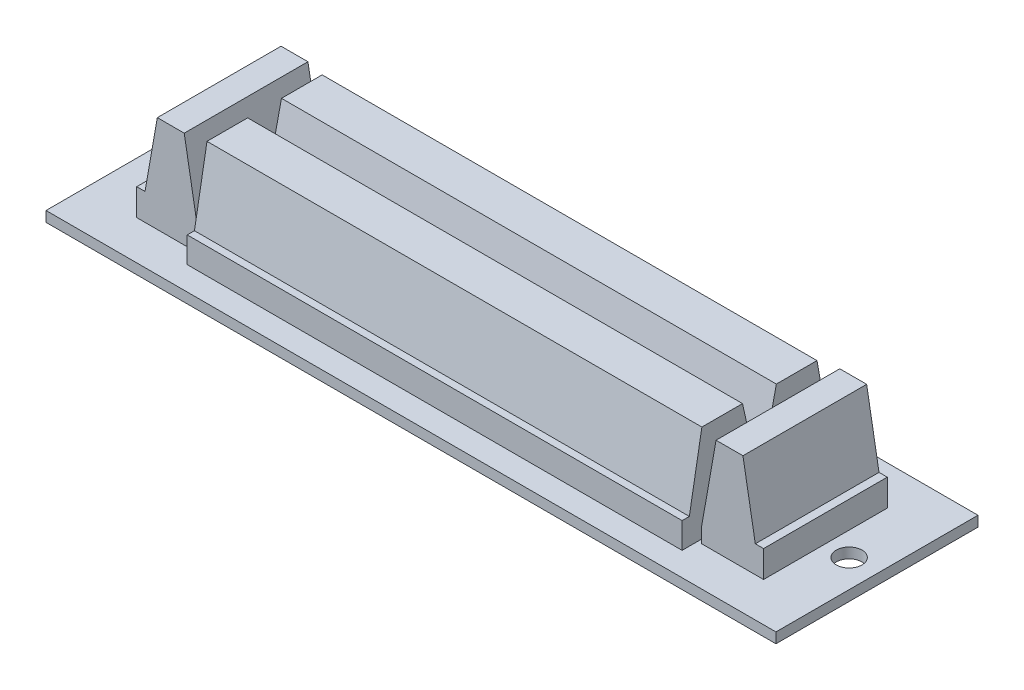
from build123d import *

# Parameters (mm, degrees)
SKETCH1_W           = 89.916
SKETCH1_H           = 24.892
SKETCH1_R           = 1.5875
BOSS_EXTRUDE1_DEPTH = 0.635
BOSS_EXTRUDE2_DEPTH = 30.48
BOSS_EXTRUDE3_DEPTH = 7.62


with BuildPart() as part:
    # Sketch1 → Boss-Extrude1 (new, symmetric)
    with BuildSketch(Plane(origin=(0, 0, 0), x_dir=(1, 0, 0), z_dir=(0, 1, 0))):
        Rectangle(SKETCH1_W, SKETCH1_H)
        with Locations(Location((-41.529, 0, 0), (0, 0, 270))):
            Circle(SKETCH1_R, mode=Mode.SUBTRACT)
        with Locations(Location((41.529, 0, 0), (0, 0, 90))):
            Circle(SKETCH1_R, mode=Mode.SUBTRACT)
    extrude(amount=BOSS_EXTRUDE1_DEPTH, both=True)

    # Sketch2 → Boss-Extrude2 (add, symmetric)
    with BuildSketch(Plane(origin=(0, 0, 0), x_dir=(0, 0, -1), z_dir=(1, 0, 0))):
        Polygon((-9.525, 0.635), (-9.525, 3.81), (-8.636, 3.81), (-7.090846668, 12.573), (-2.08348644, 12.573), (0, 3.175), (2.08348644, 12.573), (7.090846668, 12.573), (8.636, 3.81), (9.525, 3.81), (9.525, 0.635), align=None)
    extrude(amount=BOSS_EXTRUDE2_DEPTH, both=True)

    # Sketch3 → Boss-Extrude3 (add, symmetric)
    with BuildSketch(Plane.XY):
        Polygon((-30.988, 0.635), (-30.988, 2.54), (-32.757088597, 12.573), (-36.069240195, 12.573), (-37.592, 3.937), (-38.608, 3.937), (-38.608, 0.635), align=None)
    boss_extrude3 = extrude(amount=BOSS_EXTRUDE3_DEPTH, both=True)

    # Mirror1: Boss-Extrude3 across plane
    add(boss_extrude3.mirror(Plane(origin=(0, 0, 0), x_dir=(0, 0, 1), z_dir=(1, 0, 0))))


solid = part.part
